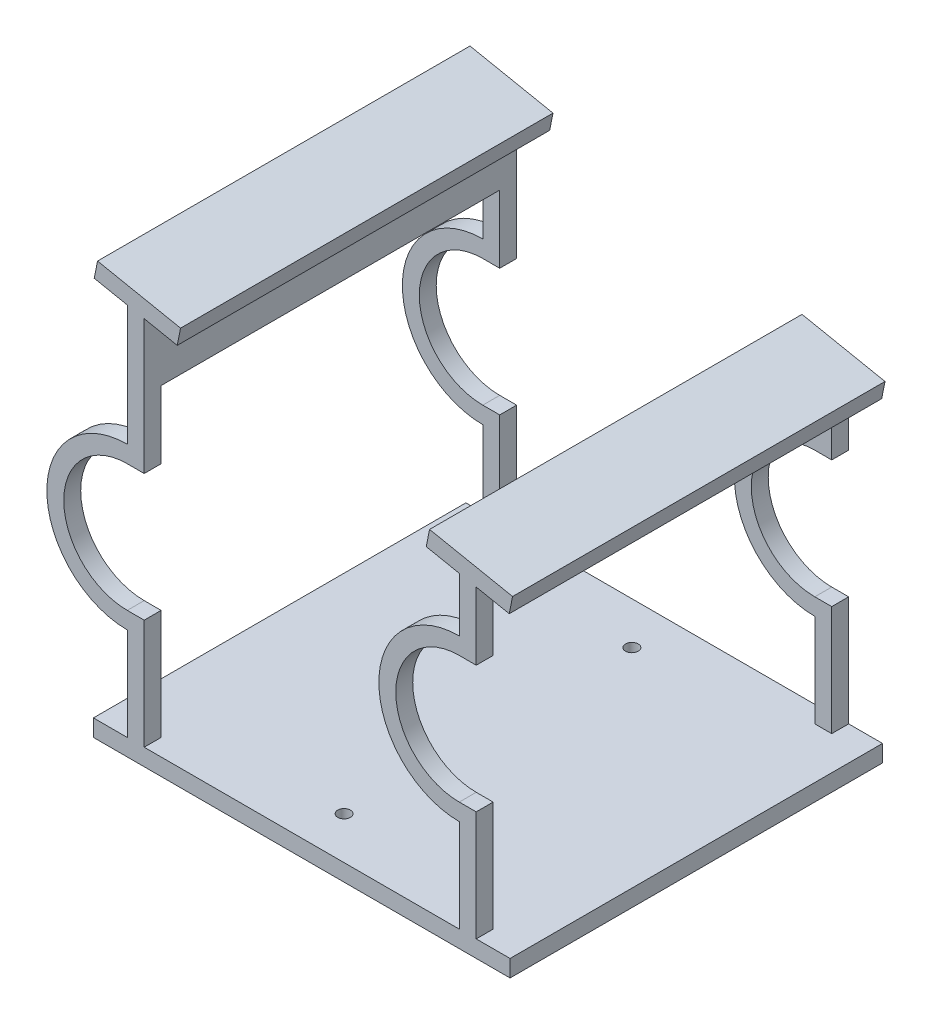
from build123d import *

# Parameters (mm, degrees)
BOSS_EXTRUDE1_DEPTH = 44
SKETCH2_W           = 40
SKETCH2_H           = 36
CUT_EXTRUDE1_DEPTH  = 87.219887541
SKETCH3_R           = 0.75
CUT_EXTRUDE2_DEPTH  = 99.468948566


with BuildPart() as part:
    # Sketch1 → Boss-Extrude1 (new body)
    with BuildSketch(Plane.XY):
        with BuildLine():
            Line((25.485483108, -5.097096622), (25.093250837, -7.058257973))
            Line((25.093250837, -7.058257973), (28.996154216, -7.838838649))
            Line((28.996154216, -7.838838649), (28.996154216, -22.083484054))
            ThreePointArc((28.996154216, -22.083484054), (19.496154216, -31.583484054), (28.996154216, -41.083484054))
            Line((28.996154216, -41.083484054), (28.996154216, -52.083484054))
            Line((28.996154216, -52.083484054), (24.996154216, -52.083484054))
            Line((24.996154216, -52.083484054), (24.996154216, -54.083484054))
            Line((24.996154216, -54.083484054), (74.219381244, -54.083484054))
            Line((74.219381244, -54.083484054), (74.219381244, -52.083484054))
            Line((74.219381244, -52.083484054), (70.219381244, -52.083484054))
            Line((70.219381244, -52.083484054), (70.219381244, -39.083484054))
            Line((70.219381244, -39.083484054), (68.219381244, -39.083484054))
            ThreePointArc((68.219381244, -39.083484054), (60.719381244, -31.583484054), (68.219381244, -24.083484054))
            Line((68.219381244, -24.083484054), (70.219381244, -24.083484054))
            Line((70.219381244, -24.083484054), (70.219381244, -20.083484054))
            Line((70.219381244, -20.083484054), (70.219381244, -16.083484054))
            Line((70.219381244, -16.083484054), (74.122284622, -16.86406473))
            Line((74.122284622, -16.86406473), (74.514516892, -14.902903378))
            Line((74.514516892, -14.902903378), (64.708710135, -12.941742027))
            Line((64.708710135, -12.941742027), (64.316477865, -14.902903378))
            Line((64.316477865, -14.902903378), (68.219381244, -15.683484054))
            Line((68.219381244, -15.683484054), (68.219381244, -22.083484054))
            ThreePointArc((68.219381244, -22.083484054), (58.719381244, -31.583484054), (68.219381244, -41.083484054))
            Line((68.219381244, -41.083484054), (68.219381244, -52.083484054))
            Line((68.219381244, -52.083484054), (30.996154216, -52.083484054))
            Line((30.996154216, -52.083484054), (30.996154216, -39.083484054))
            Line((30.996154216, -39.083484054), (28.996154216, -39.083484054))
            ThreePointArc((28.996154216, -39.083484054), (21.496154216, -31.583484054), (28.996154216, -24.083484054))
            Line((28.996154216, -24.083484054), (30.996154216, -24.083484054))
            Line((30.996154216, -24.083484054), (30.996154216, -8.238838649))
            Line((30.996154216, -8.238838649), (34.899057594, -9.019419324))
            Line((34.899057594, -9.019419324), (35.291289865, -7.058257973))
            Line((35.291289865, -7.058257973), (25.485483108, -5.097096622))
        make_face()
    extrude(amount=-BOSS_EXTRUDE1_DEPTH)

    # Sketch2 → Cut-Extrude1 (cut, through all)
    with BuildSketch(Plane(origin=(70.219381244, 0, 0), x_dir=(0, 0, -1), z_dir=(1, 0, 0))):
        with Locations((22, -34.083484054)):
            Rectangle(SKETCH2_W, SKETCH2_H)
    extrude(amount=-CUT_EXTRUDE1_DEPTH, mode=Mode.SUBTRACT)

    # Sketch3 → Cut-Extrude2 (cut, through all)
    with BuildSketch(Plane(origin=(0, -52.083484054, 0), x_dir=(1, 0, 0), z_dir=(0, 1, 0))):
        with Locations(Location((49.60776773, 39, 0), (0, 0, 180))):
            Circle(SKETCH3_R)
        with Locations(Location((49.60776773, 5, 0), (0, 0, 180))):
            Circle(SKETCH3_R)
    extrude(amount=-CUT_EXTRUDE2_DEPTH, mode=Mode.SUBTRACT)


solid = part.part
